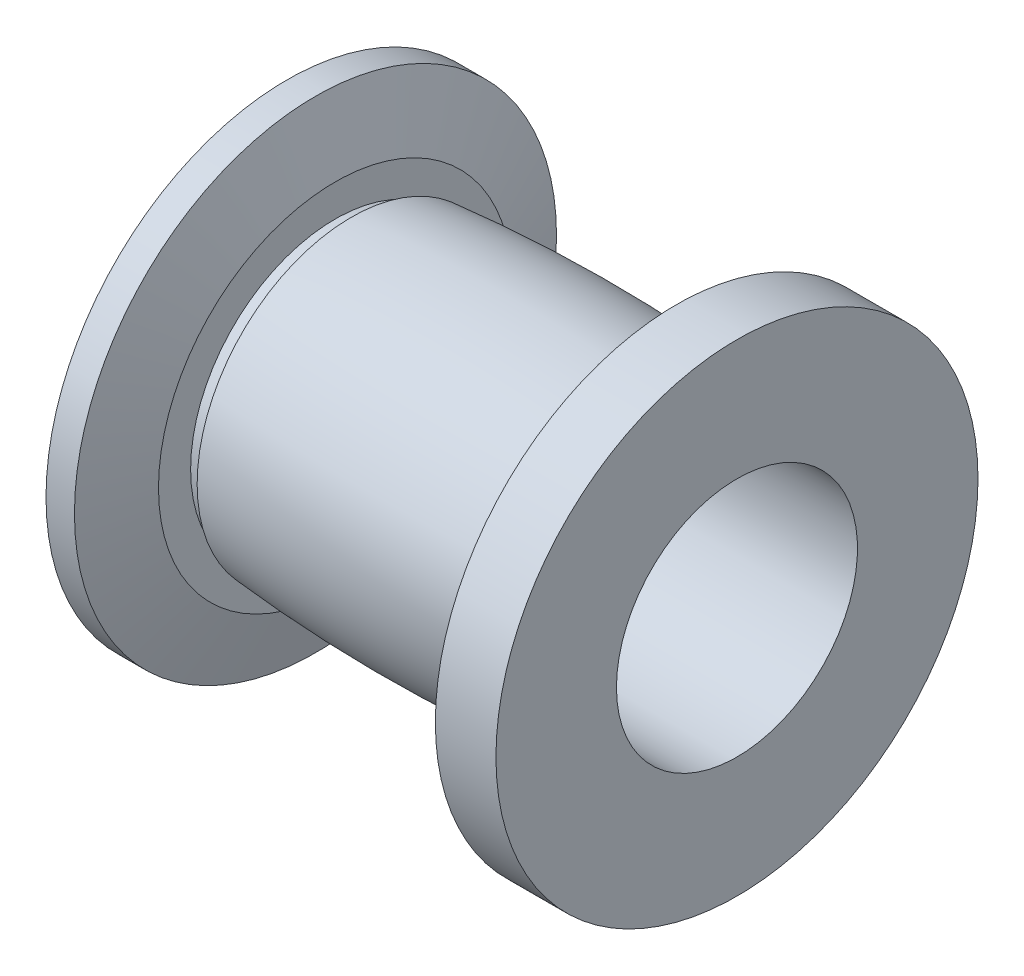
from build123d import *

# Parameters (mm, degrees)
SKETCH2_W = 28
SKETCH2_H = 7.5


with BuildPart() as part:
    # Sketch1 → Revolve1 (revolve)
    with BuildSketch(Plane.XY, mode=Mode.PRIVATE) as revolve1_sk:
        with BuildLine():
            Line((0, 0), (0, 15))
            Line((0, 15), (1.77, 15))
            Line((1.77, 15), (3, 11))
            Line((3, 11), (3, 9))
            Line((3, 9), (4, 9))
            Line((4, 9), (4, 9.594176537))
            ThreePointArc((4, 9.594176537), (13, 10), (22, 9.594176537))
            Line((22, 9.594176537), (22, 9))
            Line((22, 9), (23, 9))
            Line((23, 9), (23, 11))
            Line((23, 11), (24.23, 15))
            Line((24.23, 15), (28, 15))
            Line((28, 15), (28, 0))
            Line((28, 0), (0, 0))
        make_face()
    revolve(revolve1_sk.sketch.rotate(Axis((-3.443803602, 0, 0), (1, 0, 0)), 90), axis=Axis((-3.443803602, 0, 0), (1, 0, 0)))

    # Sketch2 → Cut-Revolve1 (revolve, cut)
    with BuildSketch(Plane.XY, mode=Mode.PRIVATE) as cut_revolve1_sk:
        with Locations((14, 3.75)):
            Rectangle(SKETCH2_W, SKETCH2_H)
    revolve(cut_revolve1_sk.sketch.rotate(Axis((-3.383783784, 0, 0), (1, 0, 0)), 90), axis=Axis((-3.383783784, 0, 0), (1, 0, 0)), mode=Mode.SUBTRACT)


solid = part.part
